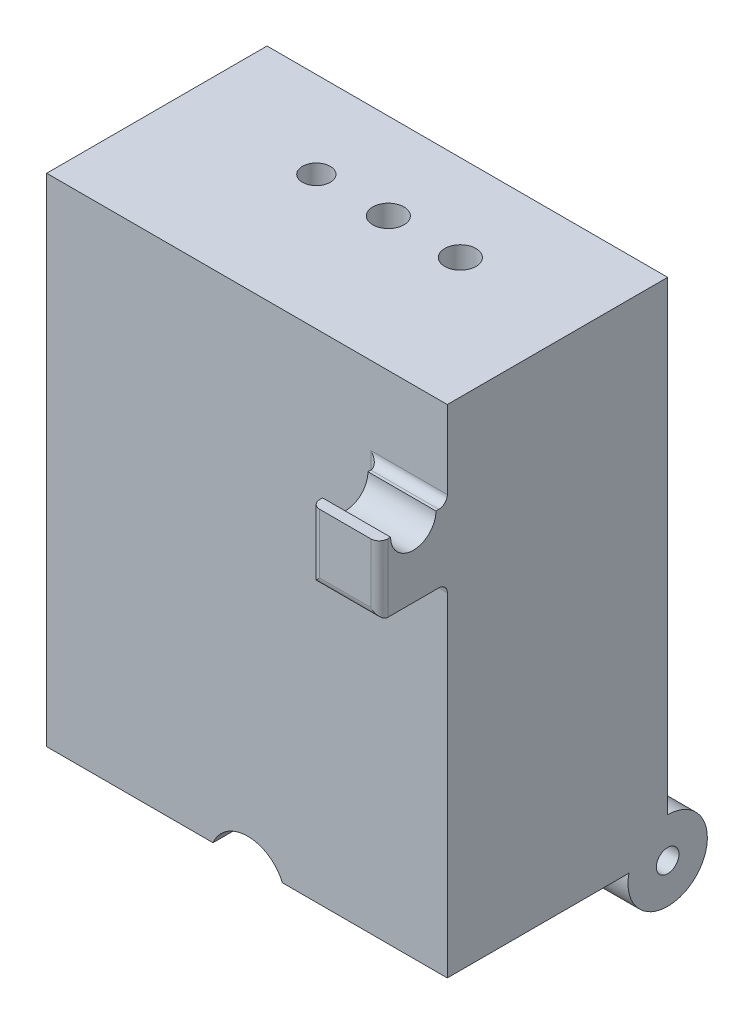
from build123d import *

# Parameters (mm, degrees)
SKETCH1_W           = 31.87
SKETCH1_H           = 71.6
BOSS_EXTRUDE1_DEPTH = 56.17
SKETCH2_W           = 72.17
SKETCH2_H           = 87.6
SKETCH2_W_2         = 58.17
SKETCH2_H_2         = 73.6
BOSS_EXTRUDE4_DEPTH = 31.87
SKETCH5_W           = 72.17
SKETCH5_H           = 87.6
BOSS_EXTRUDE5_DEPTH = 7
SKETCH6_W           = 24.87
SKETCH6_H           = 71.6
CUT_EXTRUDE2_DEPTH  = 92.222513257
SKETCH7_R           = 7
BOSS_EXTRUDE6_DEPTH = 20
BOSS_EXTRUDE7_START = -20
SKETCH8_R           = 7
BOSS_EXTRUDE7_DEPTH = 20
SKETCH9_R           = 2.753
SKETCH9_R_2         = 2.75
SKETCH9_R_3         = 2.45
CUT_EXTRUDE3_DEPTH  = 20
CUT_EXTRUDE4_DEPTH  = 40
SKETCH11_W          = 18.463529731
SKETCH11_H          = 14.991415607
CUT_EXTRUDE5_DEPTH  = 10
SKETCH12_R          = 2
CUT_EXTRUDE6_DEPTH  = 105.629761182
SKETCH13_W          = 1.5
SKETCH13_H          = 49.254465911
CUT_EXTRUDE7_DEPTH  = 128.892872897
SKETCH14_W          = 12
SKETCH14_H          = 12
BOSS_EXTRUDE8_DEPTH = 12
SKETCH15_R          = 4
CUT_EXTRUDE8_DEPTH  = 12
FILLET1_R           = 1.5


with BuildPart() as part:
    # Sketch1 → Boss-Extrude1 (new body)
    with BuildSketch(Plane(origin=(0, 0, 0), x_dir=(0, 0, -1), z_dir=(1, 0, 0))):
        Rectangle(SKETCH1_W, SKETCH1_H)
    extrude(amount=BOSS_EXTRUDE1_DEPTH)



with BuildPart() as body_2:
    # Sketch2 → Boss-Extrude4 (new body)
    with BuildSketch(Plane(origin=(0, 0, -15.935), x_dir=(-1, 0, 0), z_dir=(0, 0, -1))):
        with Locations((-28.085, 0)):
            Rectangle(SKETCH2_W, SKETCH2_H)
        with Locations((-28.085, 0)):
            Rectangle(SKETCH2_W_2, SKETCH2_H_2, mode=Mode.SUBTRACT)
    extrude(amount=BOSS_EXTRUDE4_DEPTH)


with BuildPart() as part_1:
    add(part.part)

    add(body_2.part)  # Boss-Extrude5 merges body 2
    # Sketch5 → Boss-Extrude5 (add)
    with BuildSketch(Plane.XY.offset(-15.935)):
        with Locations((28.085, 0)):
            Rectangle(SKETCH5_W, SKETCH5_H)
    extrude(amount=BOSS_EXTRUDE5_DEPTH)

    # Sketch6 → Cut-Extrude2 (cut, through all)
    with BuildSketch(Plane.ZY):
        with Locations((3.5, 0)):
            Rectangle(SKETCH6_W, SKETCH6_H)
    extrude(amount=-CUT_EXTRUDE2_DEPTH, mode=Mode.SUBTRACT)

    # Sketch7 → Boss-Extrude6 (add)
    with BuildSketch(Plane.ZY.offset(8)):
        with Locations((-47.805, -45.3)):
            Circle(SKETCH7_R)
    extrude(amount=-BOSS_EXTRUDE6_DEPTH)

    # Sketch8 → Boss-Extrude7 (add)
    with BuildSketch(Plane(origin=(64.17, 0, 0), x_dir=(0, 0, -1), z_dir=(1, 0, 0)).offset(BOSS_EXTRUDE7_START)):
        with Locations((47.805, -45.3)):
            Circle(SKETCH8_R)
    extrude(amount=BOSS_EXTRUDE7_DEPTH)

    # Sketch9 → Cut-Extrude3 (cut)
    with BuildSketch(Plane(origin=(0, 43.8, 0), x_dir=(1, 0, 0), z_dir=(0, 1, 0))):
        with Locations(Location((41.35, 32.555, 0), (0, 0, 270))):
            Circle(SKETCH9_R)
        with Locations(Location((28.65, 32.555, 0), (0, 0, 270))):
            Circle(SKETCH9_R_2)
        with Locations(Location((15.95, 32.555, 0), (0, 0, 270))):
            Circle(SKETCH9_R_3)
    extrude(amount=-CUT_EXTRUDE3_DEPTH, mode=Mode.SUBTRACT)

    # Sketch10 → Cut-Extrude4 (cut)
    with BuildSketch(Plane(origin=(0, 0, -47.805), x_dir=(-1, 0, 0), z_dir=(0, 0, -1))):
        with BuildLine():
            Line((-33.567827079, -43.8), (-21.344405358, -43.8))
            ThreePointArc((-21.344405358, -43.8), (-27.456116219, -39.739220659), (-33.567827079, -43.8))
        make_face()
    extrude(amount=-CUT_EXTRUDE4_DEPTH, mode=Mode.SUBTRACT)

    # Sketch11 → Cut-Extrude5 (cut)
    with BuildSketch(Plane.ZY.offset(8)):
        with Locations((-34.516340539, -19.295707804)):
            Rectangle(SKETCH11_W, SKETCH11_H)
    extrude(amount=-CUT_EXTRUDE5_DEPTH, mode=Mode.SUBTRACT)

    # Sketch12 → Cut-Extrude6 (cut, through all)
    with BuildSketch(Plane.ZY.offset(8)):
        with Locations((-47.805, -45.3)):
            Circle(SKETCH12_R)
    extrude(amount=-CUT_EXTRUDE6_DEPTH, mode=Mode.SUBTRACT)

    # Sketch13 → Cut-Extrude7 (cut, through all)
    with BuildSketch(Plane(origin=(0, 43.8, 0), x_dir=(1, 0, 0), z_dir=(0, 1, 0))):
        with Locations((63.42, 33.562232956)):
            Rectangle(SKETCH13_W, SKETCH13_H)
    extrude(amount=-CUT_EXTRUDE7_DEPTH, mode=Mode.SUBTRACT)

    # Sketch14 → Boss-Extrude8 (add)
    with BuildSketch(Plane.XY.offset(-8.935)):
        with Locations((56.67, 22.541140532)):
            Rectangle(SKETCH14_W, SKETCH14_H)
    extrude(amount=BOSS_EXTRUDE8_DEPTH)

    # Sketch15 → Cut-Extrude8 (cut)
    with BuildSketch(Plane(origin=(62.67, 0, 0), x_dir=(0, 0, -1), z_dir=(1, 0, 0))):
        with Locations((2.935, 28.541140532)):
            Circle(SKETCH15_R)
    extrude(amount=-CUT_EXTRUDE8_DEPTH, mode=Mode.SUBTRACT)

    # Fillet1
    fillet1_edges = [part_1.edges().sort_by_distance(p)[0] for p in [
        (56.67, 28.541140532, -8.935),
        (50.67, 22.541140532, -8.935),
        (56.67, 16.541140532, -8.935),
        (62.67, 22.541140532, 3.065),
        (50.67, 22.541140532, 3.065),
        (56.67, 16.541140532, 3.065),
    ]]
    fillet(fillet1_edges, radius=FILLET1_R)


solid = part_1.part
